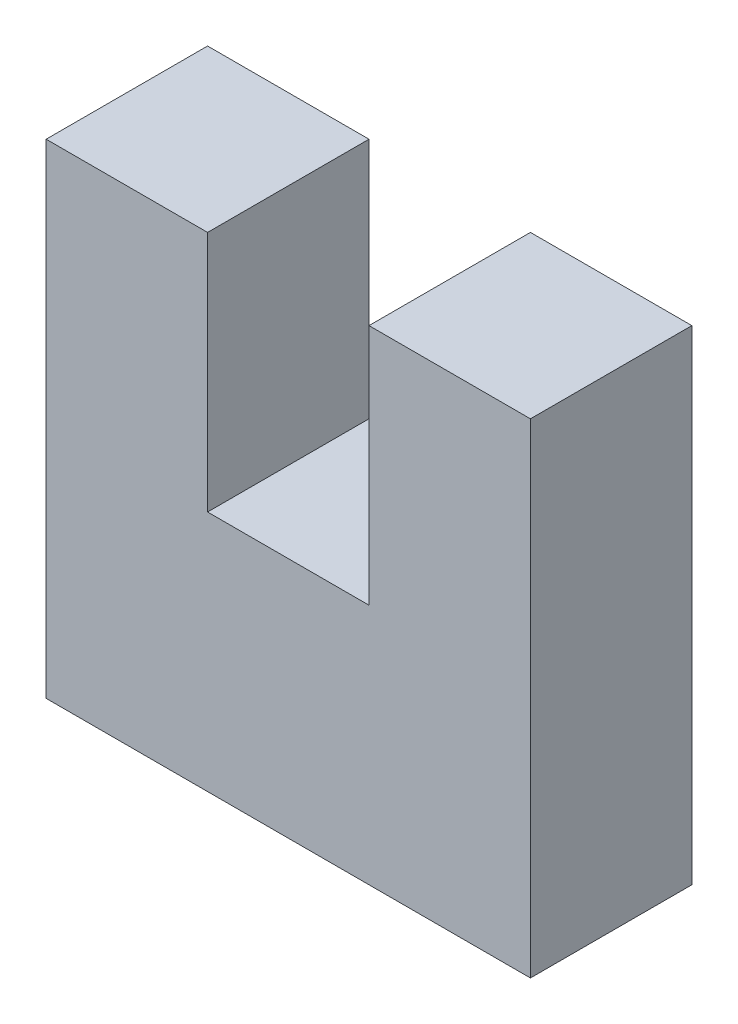
from build123d import *

# Parameters (mm, degrees)
BOSS_EXTRUDE1_DEPTH = 5.08


with BuildPart() as part:
    # Sketch2 → Boss-Extrude1 (new body)
    with BuildSketch(Plane.XY):
        Polygon((-13.074754098, 5.704590164), (-7.994754098, 5.704590164), (-7.994754098, -1.915409836), (-2.914754098, -1.915409836), (-2.914754098, 5.704590164), (2.165245902, 5.704590164), (2.165245902, -9.535409836), (-13.074754098, -9.535409836), align=None)
    extrude(amount=BOSS_EXTRUDE1_DEPTH)


solid = part.part
